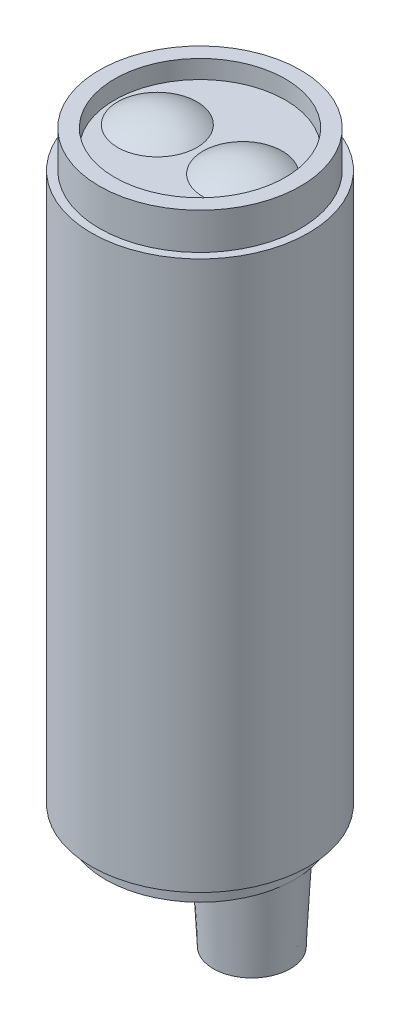
from build123d import *

# Parameters (mm, degrees)
SKETCH1_R           = 8.9
BOSS_EXTRUDE1_DEPTH = 45
SKETCH2_R           = 8.25
SKETCH2_R_2         = 7
BOSS_EXTRUDE2_DEPTH = 3
SKETCH3_R           = 7
BOSS_EXTRUDE3_DEPTH = 1.5
SKETCH6_R           = 7.75
BOSS_EXTRUDE4_DEPTH = 1.5
SKETCH7_R           = 3.5
BOSS_EXTRUDE5_DEPTH = 6.5
BOSS_EXTRUDE5_TAPER = 3


with BuildPart() as part:
    # Sketch1 → Boss-Extrude1 (new body)
    with BuildSketch(Plane(origin=(0, 0, 0), x_dir=(1, 0, 0), z_dir=(0, 1, 0))):
        with Locations(Location((0, 0, 0), (0, 0, 90))):
            Circle(SKETCH1_R)
    extrude(amount=BOSS_EXTRUDE1_DEPTH)

    # Sketch2 → Boss-Extrude2 (add)
    with BuildSketch(Plane(origin=(0, 45, 0), x_dir=(1, 0, 0), z_dir=(0, 1, 0))):
        with Locations(Location((0, 0, 0), (0, 0, 270))):
            Circle(SKETCH2_R)
        with Locations(Location((0, 0, 0), (0, 0, 270))):
            Circle(SKETCH2_R_2, mode=Mode.SUBTRACT)
    extrude(amount=BOSS_EXTRUDE2_DEPTH)

    # Sketch3 → Boss-Extrude3 (add)
    with BuildSketch(Plane(origin=(0, 45, 0), x_dir=(1, 0, 0), z_dir=(0, 1, 0))):
        with Locations(Location((0, 0, 0), (0, 0, 270))):
            Circle(SKETCH3_R)
    extrude(amount=BOSS_EXTRUDE3_DEPTH)

    # Sketch5 → Revolve5 (revolve)
    with BuildSketch(Plane.XY):
        with BuildLine():
            Line((-3.5, 46.5), (-3.5, 47.5))
            ThreePointArc((-3.5, 47.5), (-1.799816186, 47.244347394), (-0.25, 46.5))
            Line((-0.25, 46.5), (-3.5, 46.5))
        make_face()
    revolve5 = revolve(axis=Axis((-3.5, 46.5, 0), (0, 1, 0)))

    # Mirror1: Revolve5 across plane
    add(revolve5.mirror(Plane(origin=(0, 0, 0), x_dir=(0, 0, 1), z_dir=(1, 0, 0))))


with BuildPart() as body_2:
    # Sketch6 → Boss-Extrude4 (new body)
    with BuildSketch(Plane.XZ):
        with Locations(Location((0, 0, 0), (0, 0, 270))):
            Circle(SKETCH6_R)
    extrude(amount=BOSS_EXTRUDE4_DEPTH)

    # Sketch7 → Boss-Extrude5 (add)
    with BuildSketch(Plane.XZ.offset(1.5)):
        with Locations((4.25, 0)):
            Circle(SKETCH7_R)
    extrude(amount=BOSS_EXTRUDE5_DEPTH, taper=BOSS_EXTRUDE5_TAPER)


solid = Compound([part.part, body_2.part])
